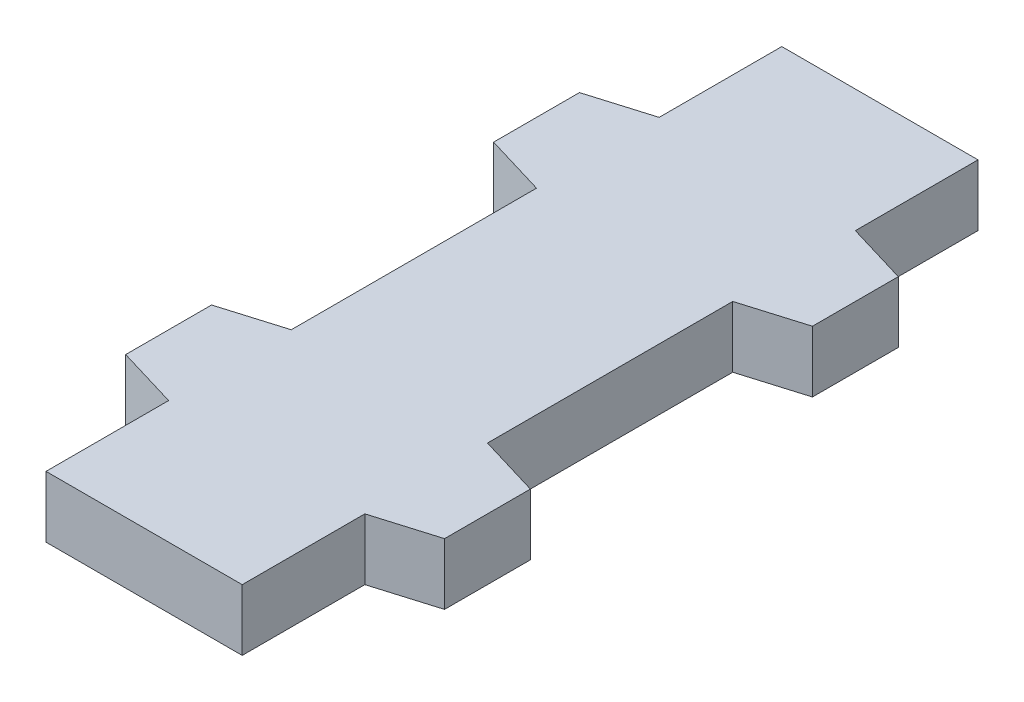
from build123d import *

# Parameters (mm, degrees)
BOSS_EXTRUDE1_DEPTH = 2.5


with BuildPart() as part:
    # Sketch1 → Boss-Extrude1 (new, symmetric)
    with BuildSketch(Plane(origin=(0, 0, 0), x_dir=(1, 0, 0), z_dir=(0, 1, 0))):
        Polygon((-8, -30), (8, -30), (8, -20), (13, -18.5), (13, -11.5), (8, -10), (8, 10), (13, 11.5), (13, 18.5), (8, 20), (8, 30), (-8, 30), (-8, 20), (-13, 18.5), (-13, 11.5), (-8, 10), (-8, -10), (-13, -11.5), (-13, -18.5), (-8, -20), align=None)
    extrude(amount=BOSS_EXTRUDE1_DEPTH, both=True)


solid = part.part
